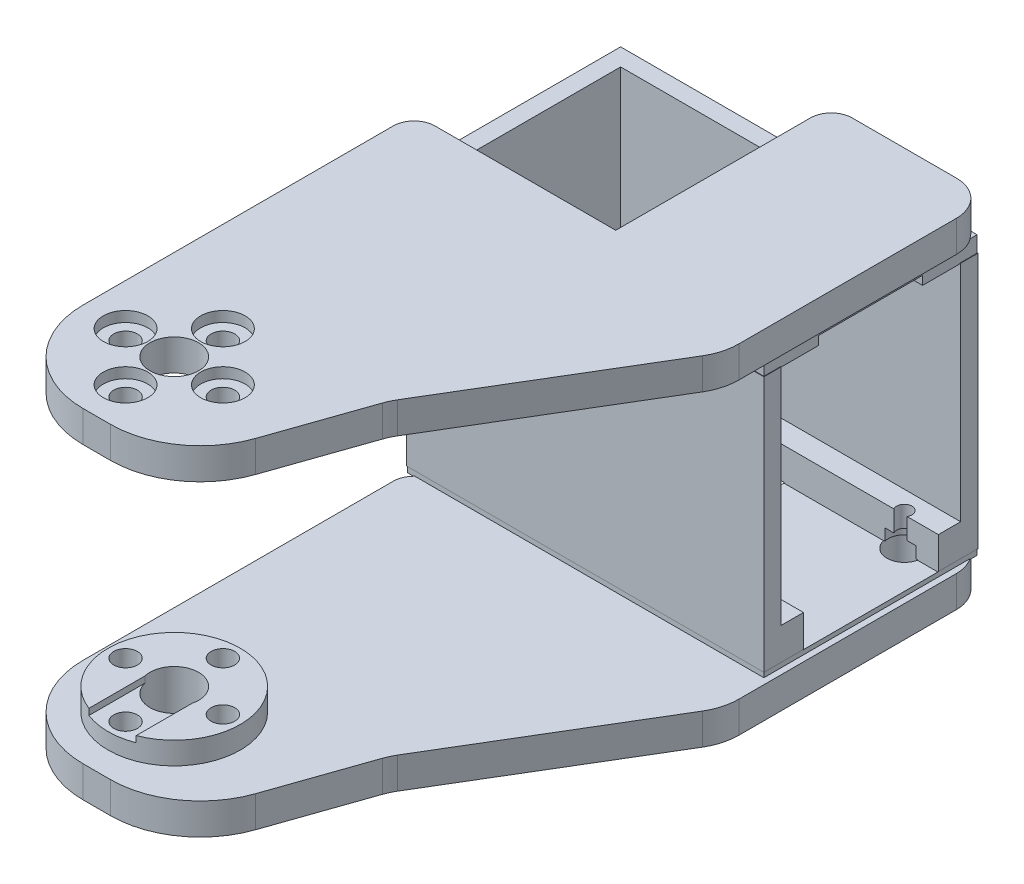
from build123d import *

# Parameters (mm, degrees)
BOSS_1_DEPTH    = 4.5
S_CYL2_R        = 9.5
BOSS_2_DEPTH    = 3.2
BOSS_3_DEPTH    = 4.5
S_BOX4_W        = 2.5
S_BOX4_H        = 36.8
BOSS_4_DEPTH    = 30.8
S_BOX5_W        = 51.4
S_BOX5_H        = 36.8
BOSS_5_DEPTH    = 2.5
S_BOX6_W        = 51.4
S_BOX6_H        = 36.8
BOSS_6_DEPTH    = 2.5
S_BOX7_W        = 51.4
S_BOX7_H        = 4.6
BOSS_7_DEPTH    = 30.8
S_BOX8_W        = 22.13
S_BOX8_H        = 2.4
BOSS_8_DEPTH    = 30.66
S_BOX9_W        = 29.16
S_BOX9_H        = 2.4
BOSS_9_DEPTH    = 1.83
S_BOX10_W       = 22.13
S_BOX10_H       = 0.95
BOSS_10_DEPTH   = 30.66
S_BOX11_W       = 29.16
S_BOX11_H       = 0.95
BOSS_11_DEPTH   = 1.83
S_HOLE12_R      = 3.5
HOLE_12_DEPTH   = 4.7
S_HOLE13_R      = 1.7
HOLE_13_DEPTH   = 4.7
S_HOLE14_R      = 1.7
HOLE_14_DEPTH   = 4.7
S_HOLE15_R      = 1.7
HOLE_15_DEPTH   = 4.7
S_HOLE16_R      = 1.7
HOLE_16_DEPTH   = 4.7
S_HOLE17_R      = 3.2
HOLE_17_DEPTH   = 1.6
S_HOLE18_R      = 3.2
HOLE_18_DEPTH   = 1.6
S_HOLE19_R      = 3.2
HOLE_19_DEPTH   = 1.6
S_HOLE20_R      = 3.2
HOLE_20_DEPTH   = 1.6
S_HOLE21_R      = 3.5
HOLE_21_DEPTH   = 7.9
S_HOLE22_R      = 1.7
HOLE_22_DEPTH   = 7.9
S_HOLE23_R      = 1.7
HOLE_23_DEPTH   = 7.9
S_HOLE24_R      = 1.7
HOLE_24_DEPTH   = 7.9
S_HOLE25_R      = 1.7
HOLE_25_DEPTH   = 7.9
S_HOLE26_R      = 3.2
HOLE_26_DEPTH   = 2.1
S_HOLE27_R      = 3.2
HOLE_27_DEPTH   = 2.1
S_HOLE28_R      = 3.2
HOLE_28_DEPTH   = 2.1
S_HOLE29_R      = 3.2
HOLE_29_DEPTH   = 2.1
S_CUT30_W       = 6.8
S_CUT30_H       = 1
POCKET_30_DEPTH = 10
S_HOLE31_R      = 10.5
HOLE_31_DEPTH   = 4.8
S_CUT32_W       = 19.5
S_CUT32_H       = 4.75
POCKET_32_DEPTH = 19.4
S_CUT33_W       = 8.3
S_CUT33_H       = 4.75
POCKET_33_DEPTH = 19.4
S_CUT34_W       = 11
S_CUT34_H       = 4.75
POCKET_34_DEPTH = 7
S_CUT35_W       = 20
S_CUT35_H       = 2.9
POCKET_35_DEPTH = 15.9
S_HOLE36_R      = 1.1
HOLE_36_DEPTH   = 4.8
S_HOLE37_R      = 2.3
HOLE_37_DEPTH   = 1.7
S_HOLE38_R      = 1.1
HOLE_38_DEPTH   = 4.8
S_HOLE39_R      = 2.3
HOLE_39_DEPTH   = 1.7
S_HOLE40_R      = 1.1
HOLE_40_DEPTH   = 4.8
S_HOLE41_R      = 2.3
HOLE_41_DEPTH   = 1.7
S_CUT42_W       = 30.6
S_CUT42_H       = 1.55
POCKET_42_DEPTH = 15
S_HOLE43_R      = 2.5
HOLE_43_DEPTH   = 5.3
S_HOLE44_R      = 2.5
HOLE_44_DEPTH   = 5.3
CUT_45_DEPTH    = 4.9
CUT_46_DEPTH    = 32


with BuildPart() as part:
    # S_prism1 → Boss_1 (new body)
    with BuildSketch(Plane(origin=(0, 18.8, 0), x_dir=(1, 0, 0), z_dir=(0, 1, 0))):
        with BuildLine():
            Line((-0.1, -13), (3.8289, -13))
            ThreePointArc((3.8289, -13), (11.303548347, -10.613765629), (16.0129, -4.3379))
            Line((16.0129, -4.3379), (20.7288, 9.2202))
            ThreePointArc((20.7288, 9.2202), (21.038506496, 9.982013886), (21.4248, 10.708))
            Line((21.4248, 10.708), (37.8599, 38.0999))
            ThreePointArc((37.8599, 38.0999), (38.709702939, 40.080410611), (39, 42.2159))
            Line((39, 42.2159), (39, 73.5))
            ThreePointArc((39, 73.5), (37.5355, 77.0355), (34, 78.5))
            Line((34, 78.5), (19, 78.5))
            ThreePointArc((19, 78.5), (16.8787, 77.6213), (16, 75.5))
            Line((16, 75.5), (16, 47.5))
            Line((16, 47.5), (-10, 47.5))
            ThreePointArc((-10, 47.5), (-12.1213, 46.6213), (-13, 44.5))
            Line((-13, 44.5), (-13, -0.1))
            ThreePointArc((-13, -0.1), (-9.2217, -9.2217), (-0.1, -13))
        make_face()
    extrude(amount=BOSS_1_DEPTH)



with BuildPart() as body_2:
    # S_cyl2 → Boss_2 (new body)
    with BuildSketch(Plane(origin=(0, -20.95, 0), x_dir=(1, 0, 0), z_dir=(0, 1, 0))):
        Circle(S_CYL2_R)
    extrude(amount=BOSS_2_DEPTH)

    # S_prism3 → Boss_3 (add)
    with BuildSketch(Plane(origin=(0, -25.45, 0), x_dir=(1, 0, 0), z_dir=(0, 1, 0))):
        with BuildLine():
            Line((-0.1, -13), (3.8289, -13))
            ThreePointArc((3.8289, -13), (11.303548347, -10.613765629), (16.0129, -4.3379))
            Line((16.0129, -4.3379), (20.7288, 9.2202))
            ThreePointArc((20.7288, 9.2202), (21.038506496, 9.982013886), (21.4248, 10.708))
            Line((21.4248, 10.708), (37.8599, 38.0999))
            ThreePointArc((37.8599, 38.0999), (38.709702939, 40.080410611), (39, 42.2159))
            Line((39, 42.2159), (39, 73.5))
            ThreePointArc((39, 73.5), (37.5355, 77.0355), (34, 78.5))
            Line((34, 78.5), (19, 78.5))
            ThreePointArc((19, 78.5), (16.8787, 77.6213), (16, 75.5))
            Line((16, 75.5), (16, 47.5))
            Line((16, 47.5), (-10, 47.5))
            ThreePointArc((-10, 47.5), (-12.1213, 46.6213), (-13, 44.5))
            Line((-13, 44.5), (-13, -0.1))
            ThreePointArc((-13, -0.1), (-9.2217, -9.2217), (-0.1, -13))
        make_face()
    extrude(amount=BOSS_3_DEPTH)


with BuildPart() as body_3:
    # S_box4 → Boss_4 (new body)
    with BuildSketch(Plane.XY.offset(-77.4)):
        with Locations((-11.95, -1.8)):
            Rectangle(S_BOX4_W, S_BOX4_H)
    extrude(amount=BOSS_4_DEPTH)

    # S_box5 → Boss_5 (add)
    with BuildSketch(Plane.XY.offset(-77.4)):
        with Locations((12.5, -1.8)):
            Rectangle(S_BOX5_W, S_BOX5_H)
    extrude(amount=BOSS_5_DEPTH)

    # S_box6 → Boss_6 (add)
    with BuildSketch(Plane.XY.offset(-49.1)):
        with Locations((12.5, -1.8)):
            Rectangle(S_BOX6_W, S_BOX6_H)
    extrude(amount=BOSS_6_DEPTH)

    # S_box7 → Boss_7 (add)
    with BuildSketch(Plane.XY.offset(-77.4)):
        with Locations((12.5, -17.9)):
            Rectangle(S_BOX7_W, S_BOX7_H)
    extrude(amount=BOSS_7_DEPTH)


with BuildPart() as part_1:
    add(part.part)

    add(body_3.part)  # Boss_8 merges body 3
    # S_box8 → Boss_8 (add)
    with BuildSketch(Plane.XY.offset(-77.33)):
        with Locations((27.065, 17.7)):
            Rectangle(S_BOX8_W, S_BOX8_H)
    extrude(amount=BOSS_8_DEPTH)

    # S_box9 → Boss_9 (add)
    with BuildSketch(Plane.XY.offset(-48.5)):
        with Locations((1.45, 17.7)):
            Rectangle(S_BOX9_W, S_BOX9_H)
    extrude(amount=BOSS_9_DEPTH)


    add(body_2.part)  # Boss_10 merges body 2
    # S_box10 → Boss_10 (add)
    with BuildSketch(Plane.XY.offset(-77.33)):
        with Locations((27.065, -20.575)):
            Rectangle(S_BOX10_W, S_BOX10_H)
    extrude(amount=BOSS_10_DEPTH)

    # S_box11 → Boss_11 (add)
    with BuildSketch(Plane.XY.offset(-48.5)):
        with Locations((1.45, -20.575)):
            Rectangle(S_BOX11_W, S_BOX11_H)
    extrude(amount=BOSS_11_DEPTH)

    # S_hole12 → Hole_12 (cut)
    with BuildSketch(Plane(origin=(0, 18.7, 0), x_dir=(1, 0, 0), z_dir=(0, 1, 0))):
        Circle(S_HOLE12_R)
    extrude(amount=HOLE_12_DEPTH, mode=Mode.SUBTRACT)

    # S_hole13 → Hole_13 (cut)
    with BuildSketch(Plane(origin=(0, 18.7, 0), x_dir=(1, 0, 0), z_dir=(0, 1, 0))):
        with Locations((7, 0)):
            Circle(S_HOLE13_R)
    extrude(amount=HOLE_13_DEPTH, mode=Mode.SUBTRACT)

    # S_hole14 → Hole_14 (cut)
    with BuildSketch(Plane(origin=(0, 18.7, 0), x_dir=(1, 0, 0), z_dir=(0, 1, 0))):
        with Locations((0, -7)):
            Circle(S_HOLE14_R)
    extrude(amount=HOLE_14_DEPTH, mode=Mode.SUBTRACT)

    # S_hole15 → Hole_15 (cut)
    with BuildSketch(Plane(origin=(0, 18.7, 0), x_dir=(1, 0, 0), z_dir=(0, 1, 0))):
        with Locations((-7, 0)):
            Circle(S_HOLE15_R)
    extrude(amount=HOLE_15_DEPTH, mode=Mode.SUBTRACT)

    # S_hole16 → Hole_16 (cut)
    with BuildSketch(Plane(origin=(0, 18.7, 0), x_dir=(1, 0, 0), z_dir=(0, 1, 0))):
        with Locations((0, 7)):
            Circle(S_HOLE16_R)
    extrude(amount=HOLE_16_DEPTH, mode=Mode.SUBTRACT)

    # S_hole17 → Hole_17 (cut)
    with BuildSketch(Plane(origin=(0, 21.8, 0), x_dir=(1, 0, 0), z_dir=(0, 1, 0))):
        with Locations((7, 0)):
            Circle(S_HOLE17_R)
    extrude(amount=HOLE_17_DEPTH, mode=Mode.SUBTRACT)

    # S_hole18 → Hole_18 (cut)
    with BuildSketch(Plane(origin=(0, 21.8, 0), x_dir=(1, 0, 0), z_dir=(0, 1, 0))):
        with Locations((0, -7)):
            Circle(S_HOLE18_R)
    extrude(amount=HOLE_18_DEPTH, mode=Mode.SUBTRACT)

    # S_hole19 → Hole_19 (cut)
    with BuildSketch(Plane(origin=(0, 21.8, 0), x_dir=(1, 0, 0), z_dir=(0, 1, 0))):
        with Locations((-7, 0)):
            Circle(S_HOLE19_R)
    extrude(amount=HOLE_19_DEPTH, mode=Mode.SUBTRACT)

    # S_hole20 → Hole_20 (cut)
    with BuildSketch(Plane(origin=(0, 21.8, 0), x_dir=(1, 0, 0), z_dir=(0, 1, 0))):
        with Locations((0, 7)):
            Circle(S_HOLE20_R)
    extrude(amount=HOLE_20_DEPTH, mode=Mode.SUBTRACT)

    # S_hole21 → Hole_21 (cut)
    with BuildSketch(Plane(origin=(0, -25.55, 0), x_dir=(1, 0, 0), z_dir=(0, 1, 0))):
        Circle(S_HOLE21_R)
    extrude(amount=HOLE_21_DEPTH, mode=Mode.SUBTRACT)

    # S_hole22 → Hole_22 (cut)
    with BuildSketch(Plane(origin=(0, -25.55, 0), x_dir=(1, 0, 0), z_dir=(0, 1, 0))):
        with Locations((7, 0)):
            Circle(S_HOLE22_R)
    extrude(amount=HOLE_22_DEPTH, mode=Mode.SUBTRACT)

    # S_hole23 → Hole_23 (cut)
    with BuildSketch(Plane(origin=(0, -25.55, 0), x_dir=(1, 0, 0), z_dir=(0, 1, 0))):
        with Locations((0, -7)):
            Circle(S_HOLE23_R)
    extrude(amount=HOLE_23_DEPTH, mode=Mode.SUBTRACT)

    # S_hole24 → Hole_24 (cut)
    with BuildSketch(Plane(origin=(0, -25.55, 0), x_dir=(1, 0, 0), z_dir=(0, 1, 0))):
        with Locations((-7, 0)):
            Circle(S_HOLE24_R)
    extrude(amount=HOLE_24_DEPTH, mode=Mode.SUBTRACT)

    # S_hole25 → Hole_25 (cut)
    with BuildSketch(Plane(origin=(0, -25.55, 0), x_dir=(1, 0, 0), z_dir=(0, 1, 0))):
        with Locations((0, 7)):
            Circle(S_HOLE25_R)
    extrude(amount=HOLE_25_DEPTH, mode=Mode.SUBTRACT)

    # S_hole26 → Hole_26 (cut)
    with BuildSketch(Plane(origin=(0, -25.55, 0), x_dir=(1, 0, 0), z_dir=(0, 1, 0))):
        with Locations((7, 0)):
            Circle(S_HOLE26_R)
    extrude(amount=HOLE_26_DEPTH, mode=Mode.SUBTRACT)

    # S_hole27 → Hole_27 (cut)
    with BuildSketch(Plane(origin=(0, -25.55, 0), x_dir=(1, 0, 0), z_dir=(0, 1, 0))):
        with Locations((0, -7)):
            Circle(S_HOLE27_R)
    extrude(amount=HOLE_27_DEPTH, mode=Mode.SUBTRACT)

    # S_hole28 → Hole_28 (cut)
    with BuildSketch(Plane(origin=(0, -25.55, 0), x_dir=(1, 0, 0), z_dir=(0, 1, 0))):
        with Locations((-7, 0)):
            Circle(S_HOLE28_R)
    extrude(amount=HOLE_28_DEPTH, mode=Mode.SUBTRACT)

    # S_hole29 → Hole_29 (cut)
    with BuildSketch(Plane(origin=(0, -25.55, 0), x_dir=(1, 0, 0), z_dir=(0, 1, 0))):
        with Locations((0, 7)):
            Circle(S_HOLE29_R)
    extrude(amount=HOLE_29_DEPTH, mode=Mode.SUBTRACT)

    # S_cut30 → Pocket_30 (cut)
    with BuildSketch(Plane.XY):
        with Locations((0, -18.15)):
            Rectangle(S_CUT30_W, S_CUT30_H)
    extrude(amount=POCKET_30_DEPTH, mode=Mode.SUBTRACT)

    # S_hole31 → Hole_31 (cut)
    with BuildSketch(Plane(origin=(0, -20.3, 0), x_dir=(1, 0, 0), z_dir=(0, 1, 0))):
        with Locations((0, 62)):
            Circle(S_HOLE31_R)
    extrude(amount=HOLE_31_DEPTH, mode=Mode.SUBTRACT)

    # S_cut32 → Pocket_32 (cut)
    with BuildSketch(Plane.XY.offset(-71.7)):
        with Locations((20.65, -17.925)):
            Rectangle(S_CUT32_W, S_CUT32_H)
    extrude(amount=POCKET_32_DEPTH, mode=Mode.SUBTRACT)

    # S_cut33 → Pocket_33 (cut)
    with BuildSketch(Plane.XY.offset(-71.7)):
        with Locations((34.55, -17.925)):
            Rectangle(S_CUT33_W, S_CUT33_H)
    extrude(amount=POCKET_33_DEPTH, mode=Mode.SUBTRACT)

    # S_cut34 → Pocket_34 (cut)
    with BuildSketch(Plane.XY.offset(-65.5)):
        with Locations((5.5, -17.925)):
            Rectangle(S_CUT34_W, S_CUT34_H)
    extrude(amount=POCKET_34_DEPTH, mode=Mode.SUBTRACT)

    # S_cut35 → Pocket_35 (cut)
    with BuildSketch(Plane.XY.offset(-77.9)):
        with Locations((0, -18.95)):
            Rectangle(S_CUT35_W, S_CUT35_H)
    extrude(amount=POCKET_35_DEPTH, mode=Mode.SUBTRACT)

    # S_hole36 → Hole_36 (cut)
    with BuildSketch(Plane(origin=(0, -20.3, 0), x_dir=(1, 0, 0), z_dir=(0, 1, 0))):
        with Locations((8.3, 51.75)):
            Circle(S_HOLE36_R)
    extrude(amount=HOLE_36_DEPTH, mode=Mode.SUBTRACT)

    # S_hole37 → Hole_37 (cut)
    with BuildSketch(Plane(origin=(0, -20.3, 0), x_dir=(1, 0, 0), z_dir=(0, 1, 0))):
        with Locations((8.3, 51.75)):
            Circle(S_HOLE37_R)
    extrude(amount=HOLE_37_DEPTH, mode=Mode.SUBTRACT)

    # S_hole38 → Hole_38 (cut)
    with BuildSketch(Plane(origin=(0, -20.3, 0), x_dir=(1, 0, 0), z_dir=(0, 1, 0))):
        with Locations((32.75, 72.25)):
            Circle(S_HOLE38_R)
    extrude(amount=HOLE_38_DEPTH, mode=Mode.SUBTRACT)

    # S_hole39 → Hole_39 (cut)
    with BuildSketch(Plane(origin=(0, -20.3, 0), x_dir=(1, 0, 0), z_dir=(0, 1, 0))):
        with Locations((32.75, 72.25)):
            Circle(S_HOLE39_R)
    extrude(amount=HOLE_39_DEPTH, mode=Mode.SUBTRACT)

    # S_hole40 → Hole_40 (cut)
    with BuildSketch(Plane(origin=(0, -20.3, 0), x_dir=(1, 0, 0), z_dir=(0, 1, 0))):
        with Locations((32.75, 51.75)):
            Circle(S_HOLE40_R)
    extrude(amount=HOLE_40_DEPTH, mode=Mode.SUBTRACT)

    # S_hole41 → Hole_41 (cut)
    with BuildSketch(Plane(origin=(0, -20.3, 0), x_dir=(1, 0, 0), z_dir=(0, 1, 0))):
        with Locations((32.75, 51.75)):
            Circle(S_HOLE41_R)
    extrude(amount=HOLE_41_DEPTH, mode=Mode.SUBTRACT)

    # S_cut42 → Pocket_42 (cut)
    with BuildSketch(Plane.XY.offset(-69.5)):
        with Locations((23.4, 16.975)):
            Rectangle(S_CUT42_W, S_CUT42_H)
    extrude(amount=POCKET_42_DEPTH, mode=Mode.SUBTRACT)

    # S_hole43 → Hole_43 (cut)
    with BuildSketch(Plane(origin=(0, -25.55, 0), x_dir=(1, 0, 0), z_dir=(0, 1, 0))):
        with Locations((32.75, 72.25)):
            Circle(S_HOLE43_R)
    extrude(amount=HOLE_43_DEPTH, mode=Mode.SUBTRACT)

    # S_hole44 → Hole_44 (cut)
    with BuildSketch(Plane(origin=(0, -25.55, 0), x_dir=(1, 0, 0), z_dir=(0, 1, 0))):
        with Locations((32.75, 51.75)):
            Circle(S_HOLE44_R)
    extrude(amount=HOLE_44_DEPTH, mode=Mode.SUBTRACT)

    # S_pcut45 → Cut_45 (cut)
    with BuildSketch(Plane(origin=(0, -20.4, 0), x_dir=(1, 0, 0), z_dir=(0, 1, 0))):
        with BuildLine():
            Line((0.5, 78.308), (0.5, 82))
            Line((0.5, 82), (-20, 82))
            Line((-20, 82), (-20, 62))
            Line((-20, 62), (-16.3, 62))
            ThreePointArc((-16.3, 62), (-11.34548413, 73.703431775), (0.5, 78.308))
        make_face()
    extrude(amount=CUT_45_DEPTH, mode=Mode.SUBTRACT)

    # S_pcut46 → Cut_46 (cut)
    with BuildSketch(Plane(origin=(0, -15.6, 0), x_dir=(1, 0, 0), z_dir=(0, 1, 0))):
        with BuildLine():
            Line((0.5, 80.508), (0.5, 82))
            Line((0.5, 82), (-20, 82))
            Line((-20, 82), (-20, 62))
            Line((-20, 62), (-18.5, 62))
            ThreePointArc((-18.5, 62), (-12.901369895, 75.259080398), (0.5, 80.508))
        make_face()
    extrude(amount=CUT_46_DEPTH, mode=Mode.SUBTRACT)


solid = part_1.part
